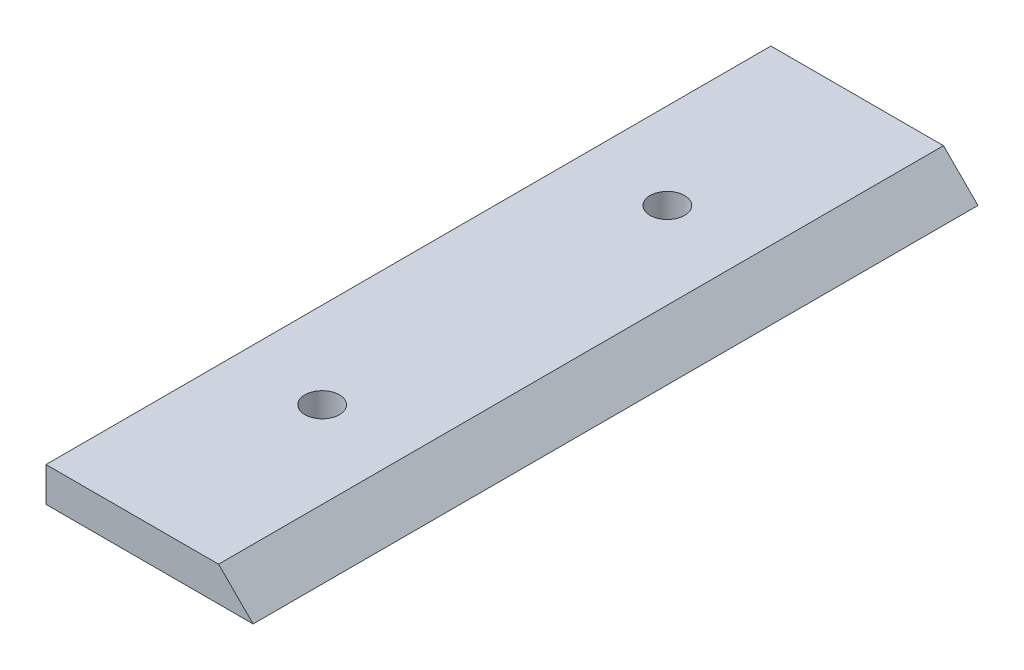
from build123d import *

# Parameters (mm, degrees)
BOSS_EXTRUDE1_DEPTH     = 105
CUT_EXTRUDE1_DEPTH      = 50
CUT_EXTRUDE1_DEPTH_BACK = 50
SKETCH2_R               = 5


with BuildPart() as part:
    # Sketch1 → Boss-Extrude1 (new, symmetric)
    with BuildSketch(Plane.XY):
        Polygon((25, 5), (35, -5), (25, -5), (-25, -5), (-25, 5), align=None)
    extrude(amount=BOSS_EXTRUDE1_DEPTH, both=True)

    # Sketch2 → Cut-Extrude1 (cut, two sides: drawn at the far end of the back side and taken through both)
    with BuildSketch(Plane(origin=(0, 0, 0), x_dir=(1, 0, 0), z_dir=(0, 1, 0)).offset(-CUT_EXTRUDE1_DEPTH_BACK)):
        with Locations(Location((0, 50, 0), (0, 0, 180))):
            Circle(SKETCH2_R)
        with Locations(Location((0, -50, 0), (0, 0, 180))):
            Circle(SKETCH2_R)
    extrude(amount=CUT_EXTRUDE1_DEPTH + CUT_EXTRUDE1_DEPTH_BACK, mode=Mode.SUBTRACT)


solid = part.part
